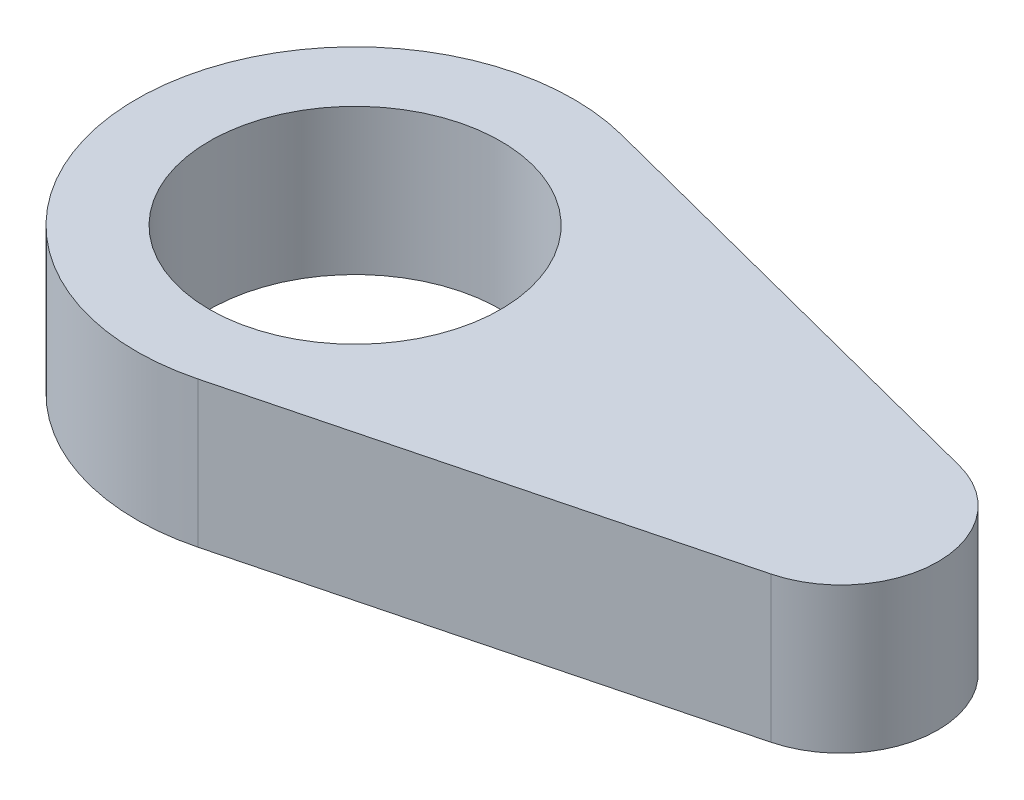
from build123d import *

# Parameters (mm, degrees)
SKETCH_1_R      = 4.5
SKETCH_1_R_2    = 3
SKETCH_1_R_3    = 2
EXTRUDE_1_DEPTH = 3


with BuildPart() as part:
    # 草图1 → 凸台-拉伸1 (new body)
    # profile 1 of 3: a face of its own
    with BuildSketch(Plane(origin=(0, 0, 0), x_dir=(1, 0, 0), z_dir=(0, 1, 0))):
        Circle(SKETCH_1_R)
        with Locations(Location((0, 0, 0), (0, 0, 270))):
            Circle(SKETCH_1_R_2, mode=Mode.SUBTRACT)
    # profile 2 of 3: a face of its own
    with BuildSketch(Plane(origin=(0, 0, 0), x_dir=(1, 0, 0), z_dir=(0, 1, 0))):
        with BuildLine():
            ThreePointArc((10.5, -1.936491675), (8, -2e-09), (10.5, 1.936491671))
            Line((10.5, 1.936491671), (1.125000001, 4.357106264))
            ThreePointArc((1.125000001, 4.357106264), (3.557562368, 2.75567596), (4.5, 0))
            ThreePointArc((4.5, 0), (3.557562367, -2.755675961), (1.124999999, -4.357106265))
            Line((1.124999999, -4.357106265), (10.5, -1.936491675))
        make_face()
    # profile 3 of 3: a face of its own
    with BuildSketch(Plane(origin=(0, 0, 0), x_dir=(1, 0, 0), z_dir=(0, 1, 0))):
        with Locations((10, -2e-09)):
            Circle(SKETCH_1_R_3)
    extrude(amount=EXTRUDE_1_DEPTH)


solid = part.part
